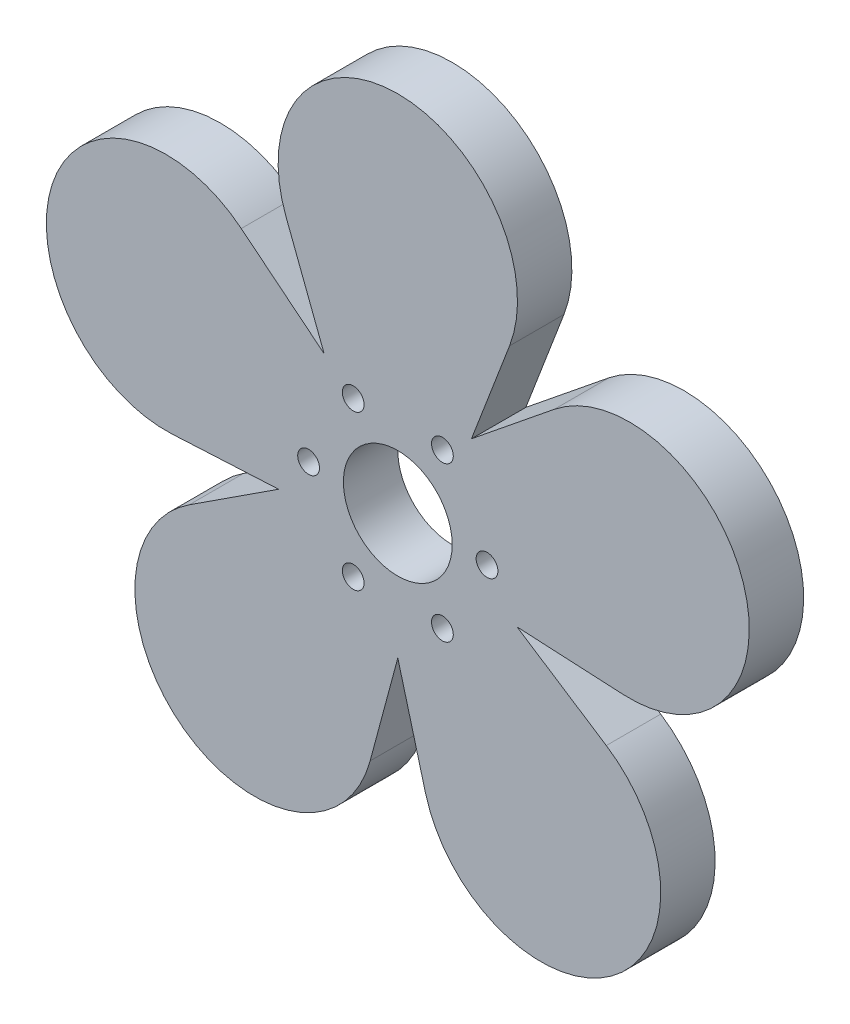
from build123d import *

# Parameters (mm, degrees)
ESTRUSIONE_ESTRUSIONE1_DEPTH = 5
SCHIZZO2_R                   = 1
TAGLIO_ESTRUSIONE1_DEPTH     = 5
SCHIZZO1_4_R                 = 5
ESTRUSIONE_ESTRUSIONE2_DEPTH = 5
SCHIZZO1_5_R                 = 5
TAGLIO_ESTRUSIONE2_DEPTH     = 5


with BuildPart() as part:
    # Schizzo1 → Estrusione-Estrusione1 (new body)
    with BuildSketch(Plane.XY):
        with BuildLine():
            Line((-10.272621339, 18.466394679), (-6.769041701, 9.316786616))
            Line((-6.769041701, 9.316786616), (-14.388170422, 15.476273245))
            ThreePointArc((-14.388170422, 15.476273245), (-31.765287644, 10.321167612), (-20.736999563, -4.063413683))
            Line((-20.736999563, -4.063413683), (-10.952539543, -3.558695821))
            Line((-10.952539543, -3.558695821), (-19.164999696, -8.901531795))
            ThreePointArc((-19.164999696, -8.901531795), (-19.632027427, -27.021167612), (-2.543549215, -20.977722446))
            Line((-2.543549215, -20.977722446), (0, -11.516181589))
            Line((0, -11.516181589), (2.543549215, -20.977722446))
            ThreePointArc((2.543549215, -20.977722446), (19.632027427, -27.021167612), (19.164999696, -8.901531795))
            Line((19.164999696, -8.901531795), (10.952539543, -3.558695821))
            Line((10.952539543, -3.558695821), (20.736999563, -4.063413683))
            ThreePointArc((20.736999563, -4.063413683), (31.765287644, 10.321167612), (14.388170422, 15.476273245))
            Line((14.388170422, 15.476273245), (6.769041701, 9.316786616))
            Line((6.769041701, 9.316786616), (10.272621339, 18.466394679))
            ThreePointArc((10.272621339, 18.466394679), (0, 33.4), (-10.272621339, 18.466394679))
        make_face()
    extrude(amount=ESTRUSIONE_ESTRUSIONE1_DEPTH)

    # Schizzo2 → Taglio-Estrusione1 (cut)
    with BuildSketch(Plane.XY.offset(5)):
        with Locations((8.2, 0)):
            Circle(SCHIZZO2_R)
        with Locations((4.1, -7.101408311)):
            Circle(SCHIZZO2_R)
        with Locations((-4.1, -7.101408311)):
            Circle(SCHIZZO2_R)
        with Locations((-8.2, 0)):
            Circle(SCHIZZO2_R)
        with Locations((-4.1, 7.101408311)):
            Circle(SCHIZZO2_R)
        with Locations((4.1, 7.101408311)):
            Circle(SCHIZZO2_R)
    extrude(amount=-TAGLIO_ESTRUSIONE1_DEPTH, mode=Mode.SUBTRACT)

    # Schizzo1<4> → Estrusione-Estrusione2 (add)
    with BuildSketch(Plane.XY):
        Circle(SCHIZZO1_4_R)
    extrude(amount=ESTRUSIONE_ESTRUSIONE2_DEPTH)

    # Schizzo1<5> → Taglio-Estrusione2 (cut)
    with BuildSketch(Plane.XY):
        Circle(SCHIZZO1_5_R)
    extrude(amount=TAGLIO_ESTRUSIONE2_DEPTH, mode=Mode.SUBTRACT)


solid = part.part
